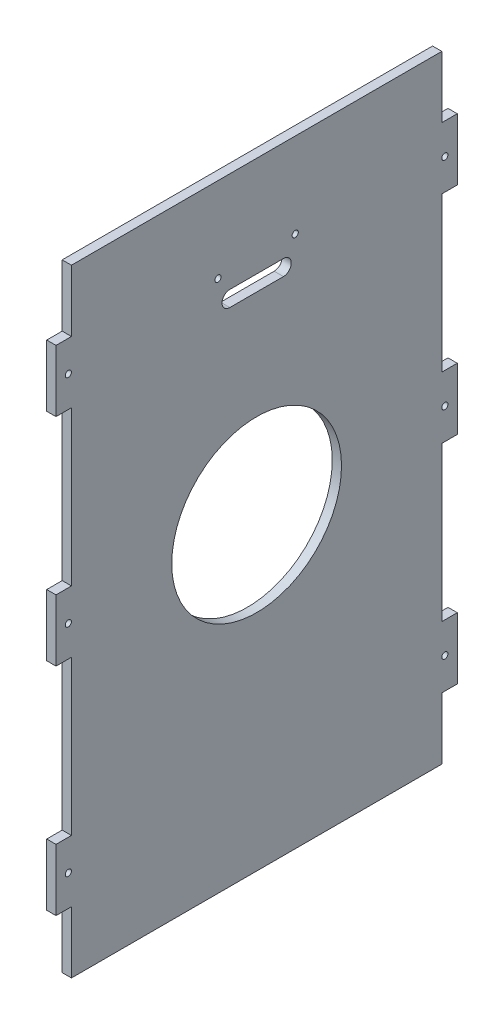
from build123d import *

# Parameters (mm, degrees)
SKETCH1_R           = 1
BOSS_EXTRUDE1_DEPTH = 3
SKETCH2_R           = 27.5
SKETCH2_R_2         = 1
CUT_EXTRUDE1_DEPTH  = 3


with BuildPart() as part:
    # Sketch1 → Boss-Extrude1 (new body)
    with BuildSketch(Plane.YZ):
        Polygon((-80, 60), (-80, 65), (-60, 65), (-60, 60), (-10, 60), (-10, 65), (10, 65), (10, 60), (60, 60), (60, 65), (80, 65), (80, 60), (100, 60), (100, -60), (80, -60), (80, -65), (60, -65), (60, -60), (10, -60), (10, -65), (-10, -65), (-10, -60), (-60, -60), (-60, -65), (-80, -65), (-80, -60), (-100, -60), (-100, 60), align=None)
        with Locations(Location((-70, 61, 0), (0, 0, 270))):
            Circle(SKETCH1_R, mode=Mode.SUBTRACT)
        with Locations(Location((70, 61, 0), (0, 0, 270))):
            Circle(SKETCH1_R, mode=Mode.SUBTRACT)
        with Locations(Location((0, 61, 0), (0, 0, 270))):
            Circle(SKETCH1_R, mode=Mode.SUBTRACT)
        with Locations(Location((70, -61, 0), (0, 0, 270))):
            Circle(SKETCH1_R, mode=Mode.SUBTRACT)
        with Locations(Location((0, -61, 0), (0, 0, 270))):
            Circle(SKETCH1_R, mode=Mode.SUBTRACT)
        with Locations(Location((-70, -61, 0), (0, 0, 270))):
            Circle(SKETCH1_R, mode=Mode.SUBTRACT)
    extrude(amount=BOSS_EXTRUDE1_DEPTH)

    # Sketch2 → Cut-Extrude1 (cut)
    with BuildSketch(Plane.YZ.offset(3)):
        with Locations(Location((0, 0, 0), (0, 0, 270))):
            Circle(SKETCH2_R)
        with Locations(Location((72.5, -12.5, 0), (0, 0, 270))):
            Circle(SKETCH2_R_2)
        with Locations(Location((72.5, 12.5, 0), (0, 0, 90))):
            Circle(SKETCH2_R_2)
        with BuildLine():
            Line((67.527461624, 8.686817334), (67.527461624, -8.686817334))
            ThreePointArc((67.527461624, -8.686817334), (64.996283302, -11.217995655), (62.465104981, -8.686817334))
            Line((62.465104981, -8.686817334), (62.465104981, 8.686817334))
            ThreePointArc((62.465104981, 8.686817334), (64.996283302, 11.217995655), (67.527461624, 8.686817334))
        make_face()
    extrude(amount=-CUT_EXTRUDE1_DEPTH, mode=Mode.SUBTRACT)


solid = part.part
